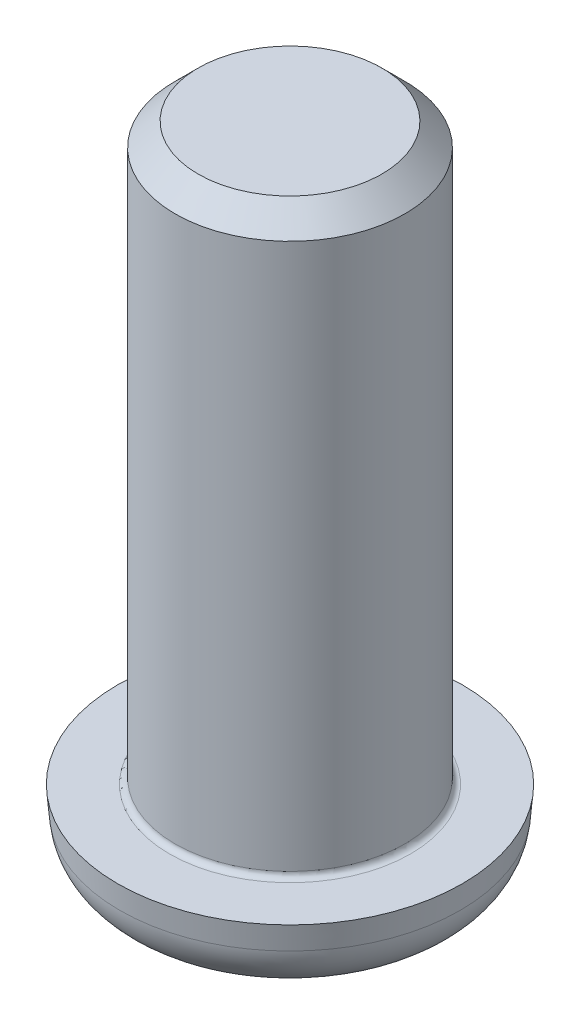
from build123d import *

# Parameters (mm, degrees)
FILLET5_R          = 0.2
CUT_EXTRUDE1_DEPTH = 1.27
CUT_EXTRUDE1_DRAFT = -3
FILLET4_R          = 0.05
CHAMFER1_SIZE      = 0.2


with BuildPart() as part:
    # Sketch1 → Revolve1 (revolve)
    with BuildSketch(Plane(origin=(0, 0, 0), x_dir=(0, 0, -1), z_dir=(1, 0, 0))):
        with BuildLine():
            Line((-1, 0), (-1, 5))
            Line((-1, 5), (0, 5))
            Line((0, 5), (0, -0.6))
            Line((0, -0.6), (-1.2, -0.6))
            ThreePointArc((-1.2, -0.6), (-1.394587635, -0.443831321), (-1.481627381, -0.21))
            Line((-1.481627381, -0.21), (-1.5, 0))
            Line((-1.5, 0), (-1, 0))
        make_face()
    revolve(axis=Axis((0, 5, 0), (0, -1, 0)))

    # Fillet5
    fillet5_edges = [part.edges().sort_by_distance(p)[0] for p in [
        (0, -0.6, -1.2),
    ]]
    fillet(fillet5_edges, radius=FILLET5_R)


with BuildPart() as cut_extrude1_tool:
    # Sketch2 → Cut-Extrude1 (with draft: the straight prism first)
    with BuildSketch(Plane.XZ.offset(0.6)):
        Polygon((0.15725, 0.15725), (0.15725, 0.925), (-0.15725, 0.925), (-0.15725, 0.15725), (-0.925, 0.15725), (-0.925, -0.15725), (-0.15725, -0.15725), (-0.15725, -0.925), (0.15725, -0.925), (0.15725, -0.15725), (0.925, -0.15725), (0.925, 0.15725), align=None)
    extrude(amount=-CUT_EXTRUDE1_DEPTH)
    # Cut-Extrude1: the draft: its side faces are tilted about the plane it starts from
    cut_extrude1_sides = [cut_extrude1_tool.faces().sort_by_distance(p)[0] for p in [
        (0.15725, 0.035, 0.541125),
        (0, 0.035, 0.925),
        (-0.15725, 0.035, 0.541125),
        (-0.541125, 0.035, 0.15725),
        (-0.925, 0.035, 0),
        (-0.541125, 0.035, -0.15725),
        (-0.15725, 0.035, -0.541125),
        (0, 0.035, -0.925),
        (0.15725, 0.035, -0.541125),
        (0.541125, 0.035, -0.15725),
        (0.925, 0.035, 0),
        (0.541125, 0.035, 0.15725),
    ]]
    draft(cut_extrude1_sides, Plane.XZ.offset(0.6), CUT_EXTRUDE1_DRAFT)


with BuildPart() as part_1:
    add(part.part)

    # Cut-Extrude1: cut by cut_extrude1_tool
    add(cut_extrude1_tool.part, mode=Mode.SUBTRACT)

    # Fillet4
    fillet4_edges = [part_1.edges().sort_by_distance(p)[0] for p in [
        (0, 0, -1),
    ]]
    fillet(fillet4_edges, radius=FILLET4_R)

    # Chamfer1
    chamfer1_edges = [part_1.edges().sort_by_distance(p)[0] for p in [
        (0, 5, -1),
    ]]
    chamfer(chamfer1_edges, length=CHAMFER1_SIZE)


solid = part_1.part
